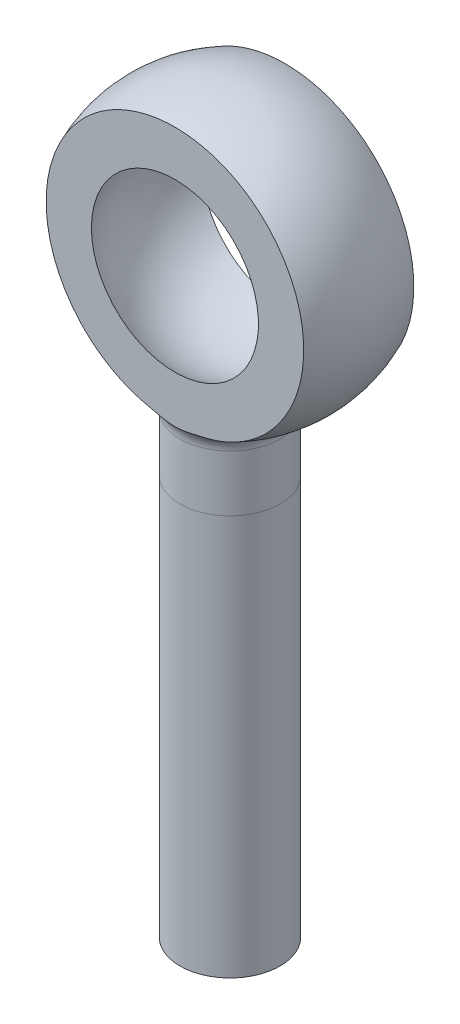
from build123d import *

# Parameters (mm, degrees)
EXTRUDE4_REACH      = 62.804
EXTRUDE4_END_RADIUS = 11.1125
SKETCH3_R           = 3.96875
FILLET4_R           = 1.5875
SKETCH2_W           = 55.88
SKETCH2_H           = 50.8
EXTRUDE3_DEPTH      = 52.296188362


with BuildPart() as part:
    # Sketch1 → Revolve2 (revolve)
    with BuildSketch(Plane.XY):
        with BuildLine():
            Line((0, 7.9375), (0, 11.1125))
            ThreePointArc((0, 11.1125), (-11.1125, 0), (0, -11.1125))
            Line((0, -11.1125), (0, -7.9375))
            ThreePointArc((0, -7.9375), (-7.9375, 0), (0, 7.9375))
        make_face()
    revolve(axis=Axis((0, 0, 0), (0, 1, 0)))

    # Extrude4: up to this sphere (the profile starts outside it)
    extrude4_end = Location((0, 0, 0)) * Sphere(EXTRUDE4_END_RADIUS, mode=Mode.PRIVATE)
    # Sketch3 → Extrude4 (add, up to the surface)
    with BuildSketch(Plane(origin=(0, -47.625, 0), x_dir=(-1, 0, 0), z_dir=(0, 1, 0)), mode=Mode.PRIVATE) as extrude4_sk1:
        Circle(SKETCH3_R)
    extrude4_tool1 = extrude(extrude4_sk1.sketch, amount=EXTRUDE4_REACH, mode=Mode.PRIVATE) - extrude4_end
    add(extrude4_tool1.solids().sort_by_distance((0, -47.625, 0))[0])

    # Fillet4
    fillet4_edges = [part.edges().sort_by_distance(p)[0] for p in [
        (3.96875, -10.379628109, 0),
    ]]
    fillet(fillet4_edges, radius=FILLET4_R)

    # Sketch2 → Extrude3 (cut, through all)
    with BuildSketch(Plane.XY.offset(-4.3688)):
        with Locations((0, 4.7625)):
            Rectangle(SKETCH2_W, SKETCH2_H)
    extrude3 = extrude(amount=-EXTRUDE3_DEPTH, mode=Mode.SUBTRACT)

    # Mirror1: Extrude3 across plane
    add(extrude3.mirror(Plane.XY), mode=Mode.SUBTRACT)


solid = part.part
